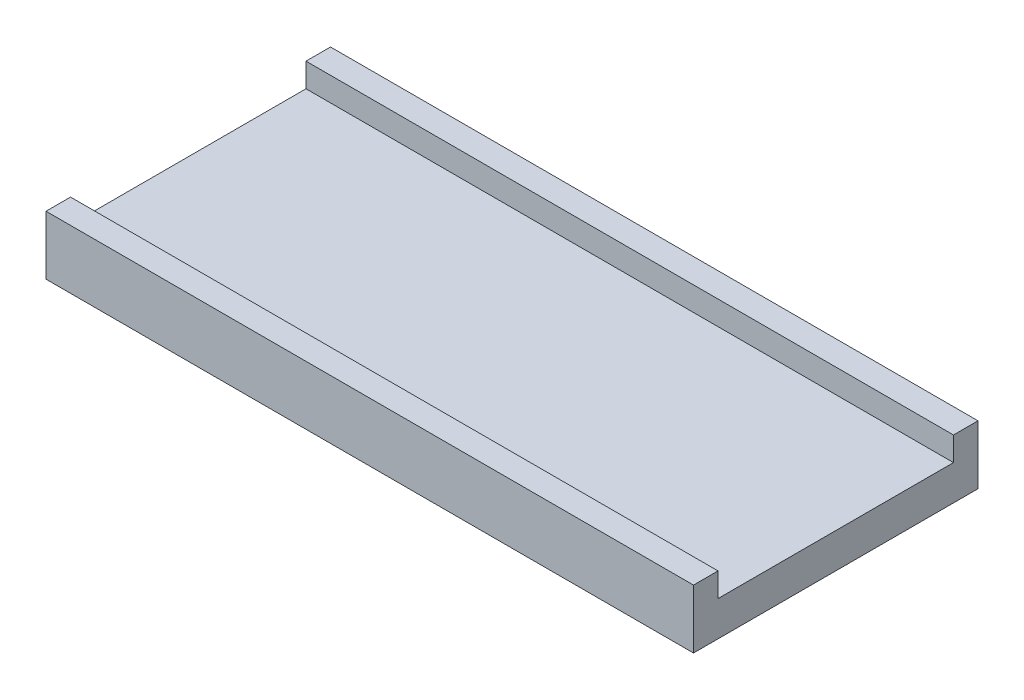
from build123d import *

# Parameters (mm, degrees)
SKETCH1_W           = 165
SKETCH1_H           = 72.5
BOSS_EXTRUDE1_DEPTH = 15
SKETCH2_W           = 165
SKETCH2_H           = 60
CUT_EXTRUDE1_DEPTH  = 6.1


with BuildPart() as part:
    # Sketch1 → Boss-Extrude1 (new body)
    with BuildSketch(Plane(origin=(0, 0, 0), x_dir=(1, 0, 0), z_dir=(0, 1, 0))):
        Rectangle(SKETCH1_W, SKETCH1_H)
    extrude(amount=BOSS_EXTRUDE1_DEPTH)

    # Sketch2 → Cut-Extrude1 (cut)
    with BuildSketch(Plane(origin=(0, 15, 0), x_dir=(1, 0, 0), z_dir=(0, 1, 0))):
        Rectangle(SKETCH2_W, SKETCH2_H)
    extrude(amount=-CUT_EXTRUDE1_DEPTH, mode=Mode.SUBTRACT)


solid = part.part
